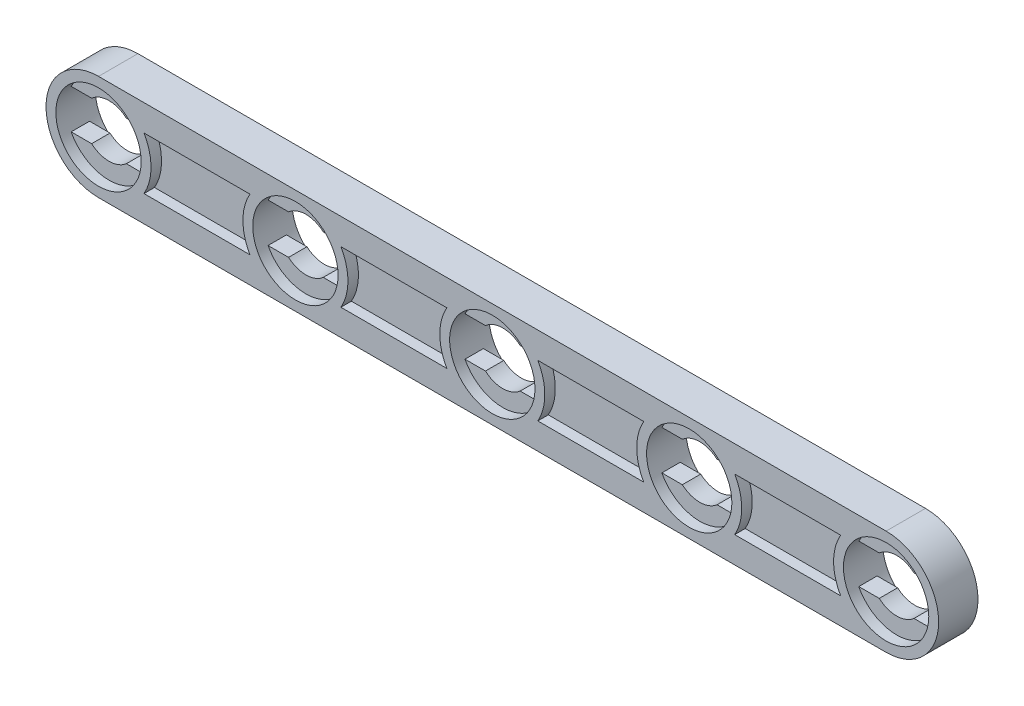
from build123d import *

# Parameters (mm, degrees)
EXTRUDE_1_DEPTH          = 3
CUT_EXTRUDE_1_REACH      = 66.195
SKETCH_3_R               = 3.25
CUT_EXTRUDE_2_DEPTH      = 0.8
CUT_EXTRUDE_START        = -2.2
SKETCH_3_2_R             = 3.25
CUT_EXTRUDE_3_DEPTH      = 0.8
CUT_EXTRUDE_4_DEPTH      = 0.8
SKETCH_5_W               = 7
SKETCH_5_H               = 4
CUT_EXTRUDE_6_DEPTH      = 0.8
MIRROR_2_COPY_1_REACH    = 66.195
MIRROR_2_COPY_2_SKETCH_R = 3.25
MIRROR_2_COPY_2_DEPTH    = 0.8
MIRROR_START             = -2.2
MIRROR_2_COPY_3_SKETCH_R = 3.25
MIRROR_2_COPY_3_DEPTH    = 0.8


with BuildPart() as part:
    # 草图1 → 凸台-拉伸1 (new body)
    with BuildSketch(Plane.XY):
        with BuildLine():
            Line((0, 4), (60, 4))
            ThreePointArc((60, 4), (64, 0), (60, -4))
            Line((60, -4), (0, -4))
            ThreePointArc((0, -4), (-4, 0), (0, 4))
        make_face()
    extrude(amount=-EXTRUDE_1_DEPTH)

    # 草图2 → 切除-拉伸1 (cut, up to next)
    with BuildSketch(Plane.XY, mode=Mode.PRIVATE) as cut_extrude_1_sk1:
        with BuildLine():
            Line((1.322875656, -1.5), (2.883140649, -1.5))
            ThreePointArc((2.883140649, -1.5), (3.25, 0), (2.883140649, 1.5))
            Line((2.883140649, 1.5), (1.322875656, 1.5))
            ThreePointArc((1.322875656, 1.5), (0, 2), (-1.322875656, 1.5))
            Line((-1.322875656, 1.5), (-2.883140649, 1.5))
            ThreePointArc((-2.883140649, 1.5), (-3.25, 0), (-2.883140649, -1.5))
            Line((-2.883140649, -1.5), (-1.322875656, -1.5))
            ThreePointArc((-1.322875656, -1.5), (0, -2), (1.322875656, -1.5))
        make_face()
    cut_extrude_1_tool1 = extrude(cut_extrude_1_sk1.sketch, amount=-CUT_EXTRUDE_1_REACH, mode=Mode.PRIVATE) & part.part
    cut_extrude_1 = cut_extrude_1_tool1.solids().sort_by_distance((0, 0, 0))[0]
    add(cut_extrude_1, mode=Mode.SUBTRACT)

    # 草图3 → 切除-拉伸2 (cut)
    with BuildSketch(Plane.XY):
        Circle(SKETCH_3_R)
    cut_extrude_2 = extrude(amount=-CUT_EXTRUDE_2_DEPTH, mode=Mode.SUBTRACT)

    # 草图3<2> → 切除-拉伸3 (cut)
    with BuildSketch(Plane.XY.offset(CUT_EXTRUDE_START)):
        Circle(SKETCH_3_2_R)
    cut_extrude_3 = extrude(amount=-CUT_EXTRUDE_3_DEPTH, mode=Mode.SUBTRACT)

    # 草图4 → 切除-拉伸4 (cut)
    with BuildSketch(Plane.XY):
        with BuildLine():
            Line((3.464101615, 2), (11.535898385, 2))
            ThreePointArc((11.535898385, 2), (11, 0), (11.535898385, -2))
            Line((11.535898385, -2), (3.464101615, -2))
            ThreePointArc((3.464101615, -2), (4, 0), (3.464101615, 2))
        make_face()
    cut_extrude_4 = extrude(amount=-CUT_EXTRUDE_4_DEPTH, mode=Mode.SUBTRACT)

    # 草图5 → 切除-拉伸6 (cut)
    with BuildSketch(Plane(origin=(0, 0, -3), x_dir=(-1, 0, 0), z_dir=(0, 0, -1))):
        with Locations((-7.5, 0)):
            Rectangle(SKETCH_5_W, SKETCH_5_H)
    cut_extrude_6 = extrude(amount=-CUT_EXTRUDE_6_DEPTH, mode=Mode.SUBTRACT)

    # 镜向1: 切除-拉伸1, 切除-拉伸2, 切除-拉伸3 across plane
    add(cut_extrude_1.mirror(Plane(origin=(7.5, 0, 0), x_dir=(0, 0, 1), z_dir=(1, 0, 0))), mode=Mode.SUBTRACT)
    add(cut_extrude_2.mirror(Plane(origin=(7.5, 0, 0), x_dir=(0, 0, 1), z_dir=(1, 0, 0))), mode=Mode.SUBTRACT)
    add(cut_extrude_3.mirror(Plane(origin=(7.5, 0, 0), x_dir=(0, 0, 1), z_dir=(1, 0, 0))), mode=Mode.SUBTRACT)

    # 镜向2: 切除-拉伸1, 切除-拉伸2, 切除-拉伸3 across plane
    add(cut_extrude_1.mirror(Plane(origin=(22.5, 0, 0), x_dir=(0, 0, 1), z_dir=(1, 0, 0))), mode=Mode.SUBTRACT)
    add(cut_extrude_2.mirror(Plane(origin=(22.5, 0, 0), x_dir=(0, 0, 1), z_dir=(1, 0, 0))), mode=Mode.SUBTRACT)
    add(cut_extrude_3.mirror(Plane(origin=(22.5, 0, 0), x_dir=(0, 0, 1), z_dir=(1, 0, 0))), mode=Mode.SUBTRACT)

    # 镜向2 copy 1 sketch → 镜向2 copy 1 (cut, up to next)
    with BuildSketch(Plane(origin=(30, 0, 0), x_dir=(1, 0, 0), z_dir=(0, 0, 1)), mode=Mode.PRIVATE) as mirror_2_copy_1_sk1:
        with BuildLine():
            Line((1.322875656, -1.5), (2.883140649, -1.5))
            ThreePointArc((2.883140649, -1.5), (3.25, 0), (2.883140649, 1.5))
            Line((2.883140649, 1.5), (1.322875656, 1.5))
            ThreePointArc((1.322875656, 1.5), (0, 2), (-1.322875656, 1.5))
            Line((-1.322875656, 1.5), (-2.883140649, 1.5))
            ThreePointArc((-2.883140649, 1.5), (-3.25, 0), (-2.883140649, -1.5))
            Line((-2.883140649, -1.5), (-1.322875656, -1.5))
            ThreePointArc((-1.322875656, -1.5), (0, -2), (1.322875656, -1.5))
        make_face()
    mirror_2_copy_1_tool1 = extrude(mirror_2_copy_1_sk1.sketch, amount=-MIRROR_2_COPY_1_REACH, mode=Mode.PRIVATE) & part.part
    add(mirror_2_copy_1_tool1.solids().sort_by_distance((30, 0, 0))[0], mode=Mode.SUBTRACT)

    # 镜向2 copy 2 sketch → 镜向2 copy 2 (cut)
    with BuildSketch(Plane(origin=(30, 0, 0), x_dir=(1, 0, 0), z_dir=(0, 0, 1))):
        Circle(MIRROR_2_COPY_2_SKETCH_R)
    extrude(amount=-MIRROR_2_COPY_2_DEPTH, mode=Mode.SUBTRACT)

    # 镜向2 copy 3 sketch → 镜向2 copy 3 (cut)
    with BuildSketch(Plane(origin=(30, 0, 0), x_dir=(1, 0, 0), z_dir=(0, 0, 1)).offset(MIRROR_START)):
        Circle(MIRROR_2_COPY_3_SKETCH_R)
    extrude(amount=-MIRROR_2_COPY_3_DEPTH, mode=Mode.SUBTRACT)

    # 镜向3: 切除-拉伸4, 切除-拉伸6 across plane
    add(cut_extrude_4.mirror(Plane(origin=(15, 0, 0), x_dir=(0, 0, 1), z_dir=(1, 0, 0))), mode=Mode.SUBTRACT)
    add(cut_extrude_6.mirror(Plane(origin=(15, 0, 0), x_dir=(0, 0, 1), z_dir=(1, 0, 0))), mode=Mode.SUBTRACT)

    # 镜向4: 切除-拉伸4, 切除-拉伸6 across plane
    add(cut_extrude_4.mirror(Plane(origin=(22.5, 0, 0), x_dir=(0, 0, 1), z_dir=(1, 0, 0))), mode=Mode.SUBTRACT)
    add(cut_extrude_6.mirror(Plane(origin=(22.5, 0, 0), x_dir=(0, 0, 1), z_dir=(1, 0, 0))), mode=Mode.SUBTRACT)

    # 镜向5: 切除-拉伸1, 切除-拉伸2, 切除-拉伸3 across plane
    add(cut_extrude_1.mirror(Plane(origin=(30, 0, 0), x_dir=(0, 0, 1), z_dir=(1, 0, 0))), mode=Mode.SUBTRACT)
    add(cut_extrude_2.mirror(Plane(origin=(30, 0, 0), x_dir=(0, 0, 1), z_dir=(1, 0, 0))), mode=Mode.SUBTRACT)
    add(cut_extrude_3.mirror(Plane(origin=(30, 0, 0), x_dir=(0, 0, 1), z_dir=(1, 0, 0))), mode=Mode.SUBTRACT)

    # 镜向6: 切除-拉伸4, 切除-拉伸6 across plane
    add(cut_extrude_4.mirror(Plane(origin=(30, 0, 0), x_dir=(0, 0, 1), z_dir=(1, 0, 0))), mode=Mode.SUBTRACT)
    add(cut_extrude_6.mirror(Plane(origin=(30, 0, 0), x_dir=(0, 0, 1), z_dir=(1, 0, 0))), mode=Mode.SUBTRACT)


solid = part.part
